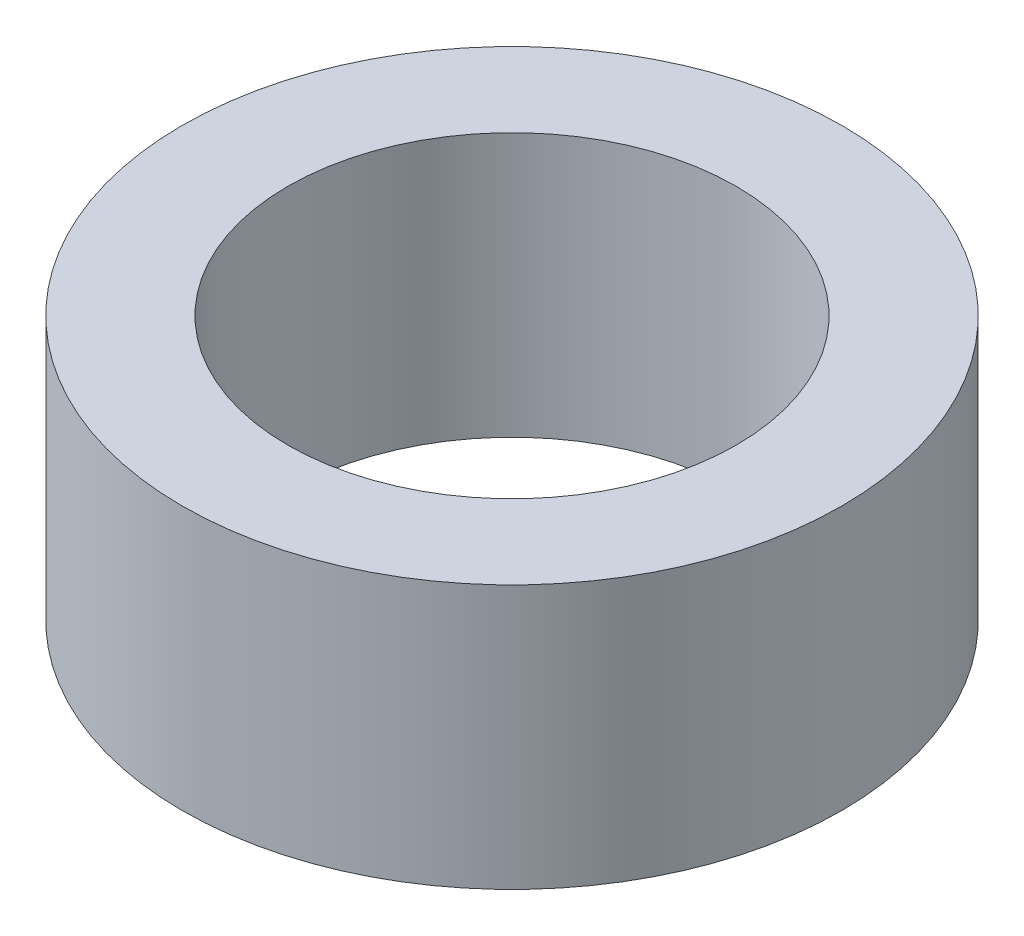
from build123d import *

# Parameters (mm, degrees)
SKETCH1_R           = 6.25
SKETCH1_R_2         = 4.25
BOSS_EXTRUDE1_DEPTH = 5


with BuildPart() as part:
    # Sketch1 → Boss-Extrude1 (new body)
    with BuildSketch(Plane(origin=(0, 0, 0), x_dir=(1, 0, 0), z_dir=(0, 1, 0))):
        with Locations(Location((0, 0, 0), (0, 0, 270))):
            Circle(SKETCH1_R)
        with Locations(Location((0, 0, 0), (0, 0, 270))):
            Circle(SKETCH1_R_2, mode=Mode.SUBTRACT)
    extrude(amount=BOSS_EXTRUDE1_DEPTH)


solid = part.part
